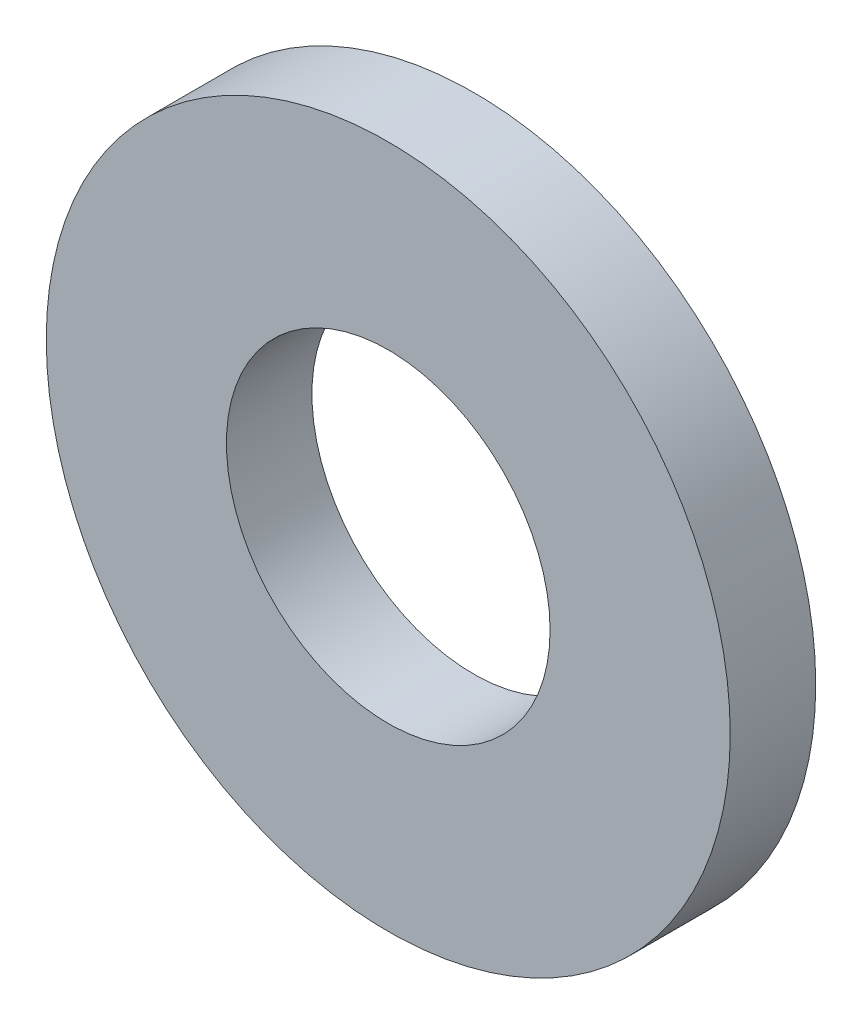
from build123d import *

# Parameters (mm, degrees)
SKETCH_1_R      = 2.8
SKETCH_1_R_2    = 1.325
EXTRUDE_1_DEPTH = 0.7


with BuildPart() as part:
    # Эскиз1 → Бобышка-Вытянуть1 (new body)
    with BuildSketch(Plane.XY):
        Circle(SKETCH_1_R)
        Circle(SKETCH_1_R_2, mode=Mode.SUBTRACT)
    extrude(amount=EXTRUDE_1_DEPTH)


solid = part.part
